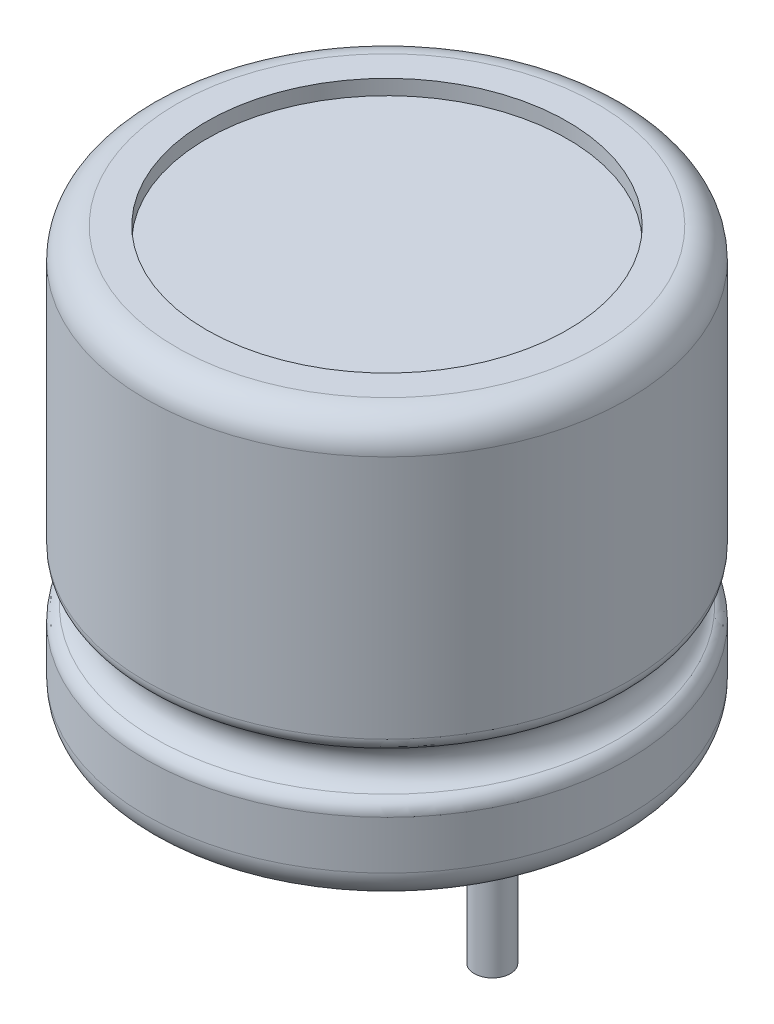
from build123d import *

# Parameters (mm, degrees)
HOLE_WIZARD_6_0_6_1_D     = 6
HOLE_WIZARD_6_0_6_1_DEPTH = 0.25
SKETCH_4_W                = 0.3
SKETCH_4_H                = 3
SKETCH_5_W                = 0.3
SKETCH_5_H                = 2
HOLE_WIZARD_6_0_6_2_D     = 6
HOLE_WIZARD_6_0_6_2_DEPTH = 0.25
FILLET_1_R                = 0.25
FILLET_2_R                = 0.5


with BuildPart() as part:
    # 草图1 → 旋转1 (revolve)
    with BuildSketch(Plane.XY):
        with BuildLine():
            Line((4, 6.99057192), (0, 6.99057192))
            Line((0, 6.99057192), (0, 0))
            Line((0, 0), (4, 0))
            Line((4, 0), (4, 1.5))
            ThreePointArc((4, 1.5), (3.63471404, 1.86528596), (4, 2.23057192))
            Line((4, 2.23057192), (4, 6.99057192))
        make_face()
    revolve(axis=Axis((0, 6.99057192, 0), (0, -1, 0)))

    # Ø6.0 (6) 直径孔1
    with Locations(Plane(origin=(0, 0, 0), x_dir=(-1, 0, 0), z_dir=(0, -1, 0))):
        with Locations((0, 0)):
            Hole(HOLE_WIZARD_6_0_6_1_D / 2, depth=HOLE_WIZARD_6_0_6_1_DEPTH)

    # 草图4 → 旋转2 (revolve)
    with BuildSketch(Plane(origin=(0, 0, 0), x_dir=(-1, 0, 0), z_dir=(0, 0, -1)), mode=Mode.PRIVATE) as revolve_2_sk:
        with Locations((-1.9, -1.25)):
            Rectangle(SKETCH_4_W, SKETCH_4_H)
    revolve(revolve_2_sk.sketch.rotate(Axis((1.75, -2.75, 0), (0, 1, 0)), 270), axis=Axis((1.75, -2.75, 0), (0, 1, 0)))

    # 草图5 → 旋转3 (revolve)
    with BuildSketch(Plane(origin=(0, 0, 0), x_dir=(-1, 0, 0), z_dir=(0, 0, -1)), mode=Mode.PRIVATE) as revolve_3_sk:
        with Locations((1.6, -0.75)):
            Rectangle(SKETCH_5_W, SKETCH_5_H)
    revolve(revolve_3_sk.sketch.rotate(Axis((-1.75, -1.75, 0), (0, 1, 0)), 270), axis=Axis((-1.75, -1.75, 0), (0, 1, 0)))

    # Ø6.0 (6) 直径孔2
    with Locations(Plane(origin=(0, 6.99057192, 0), x_dir=(1, 0, 0), z_dir=(0, 1, 0))):
        with Locations((0, 0)):
            Hole(HOLE_WIZARD_6_0_6_2_D / 2, depth=HOLE_WIZARD_6_0_6_2_DEPTH)

    # 圆角1
    fillet_1_edges = [part.edges().sort_by_distance(p)[0] for p in [
        (-4, 1.5, 0),
        (-4, 2.23057192, 0),
    ]]
    fillet(fillet_1_edges, radius=FILLET_1_R)

    # 圆角2
    fillet_2_edges = [part.edges().sort_by_distance(p)[0] for p in [
        (-4, 6.99057192, 0),
        (-4, 0, 0),
    ]]
    fillet(fillet_2_edges, radius=FILLET_2_R)


solid = part.part
